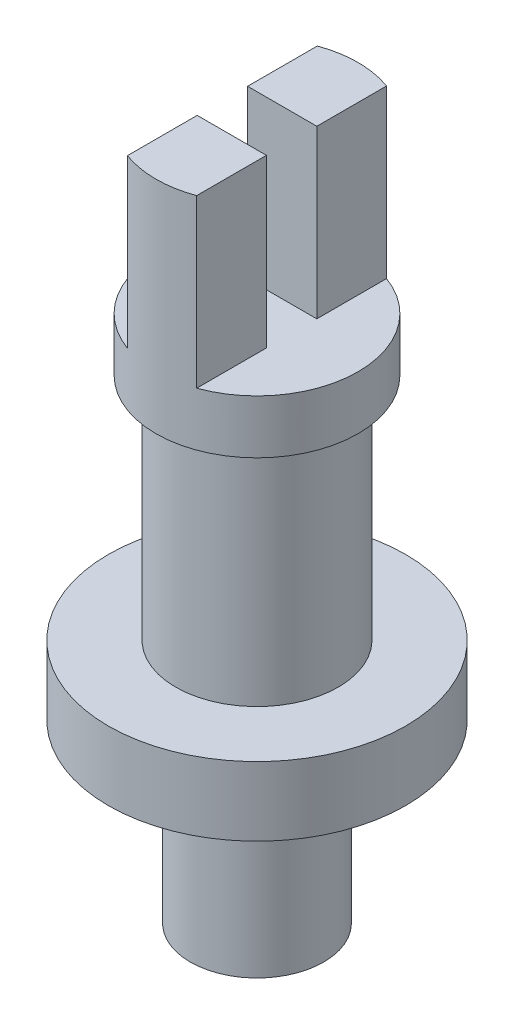
from build123d import *

# Parameters (mm, degrees)
CORTAR_EXTRUIR1_START = -4
CORTAR_EXTRUIR1_DEPTH = 4
CROQUIS7_W            = 2.599739018
CROQUIS7_H            = 1.208627888
CORTAR_EXTRUIR2_DEPTH = 4


with BuildPart() as part:
    # Croquis1 → Revolución1 (revolve)
    with BuildSketch(Plane(origin=(0, 0, 0), x_dir=(0, 0, -1), z_dir=(1, 0, 0)), mode=Mode.PRIVATE) as revoluci_n1_sk:
        Polygon((0, -4.02), (0, 0), (0, 12.65), (2.423190966, 12.65), (2.423190966, 7.363853001), (1.95, 7.363853001), (1.95, 1.863853001), (3.564484464, 1.863853001), (3.564484464, 0.210352158), (1.95, 0), (1.6, 0), (1.6, -4.02), align=None)
    revolve(revoluci_n1_sk.sketch.rotate(Axis((0, 12.65, 0), (0, -1, 0)), 180), axis=Axis((0, 12.65, 0), (0, -1, 0)))

    # Croquis6 → Cortar-Extruir1 (cut)
    with BuildSketch(Plane(origin=(0, 12.65, 0), x_dir=(1, 0, 0), z_dir=(0, 1, 0)).offset(CORTAR_EXTRUIR1_START)):
        with BuildLine():
            ThreePointArc((2.423190966, 0), (1.985316553, 1.38937851), (0.8299425, 2.276631263))
            Line((0.8299425, 2.276631263), (0.8299425, -2.276631263))
            ThreePointArc((0.8299425, -2.276631263), (1.985316553, -1.38937851), (2.423190966, 0))
        make_face()
        with BuildLine():
            Line((-0.8299425, -2.276631263), (-0.8299425, 2.276631263))
            ThreePointArc((-0.8299425, 2.276631263), (-2.423190966, 0), (-0.8299425, -2.276631263))
        make_face()
    extrude(amount=CORTAR_EXTRUIR1_DEPTH, mode=Mode.SUBTRACT)

    # Croquis7 → Cortar-Extruir2 (cut)
    with BuildSketch(Plane(origin=(0, 12.65, 0), x_dir=(1, 0, 0), z_dir=(0, 1, 0))):
        Rectangle(CROQUIS7_W, CROQUIS7_H)
    extrude(amount=-CORTAR_EXTRUIR2_DEPTH, mode=Mode.SUBTRACT)


solid = part.part
